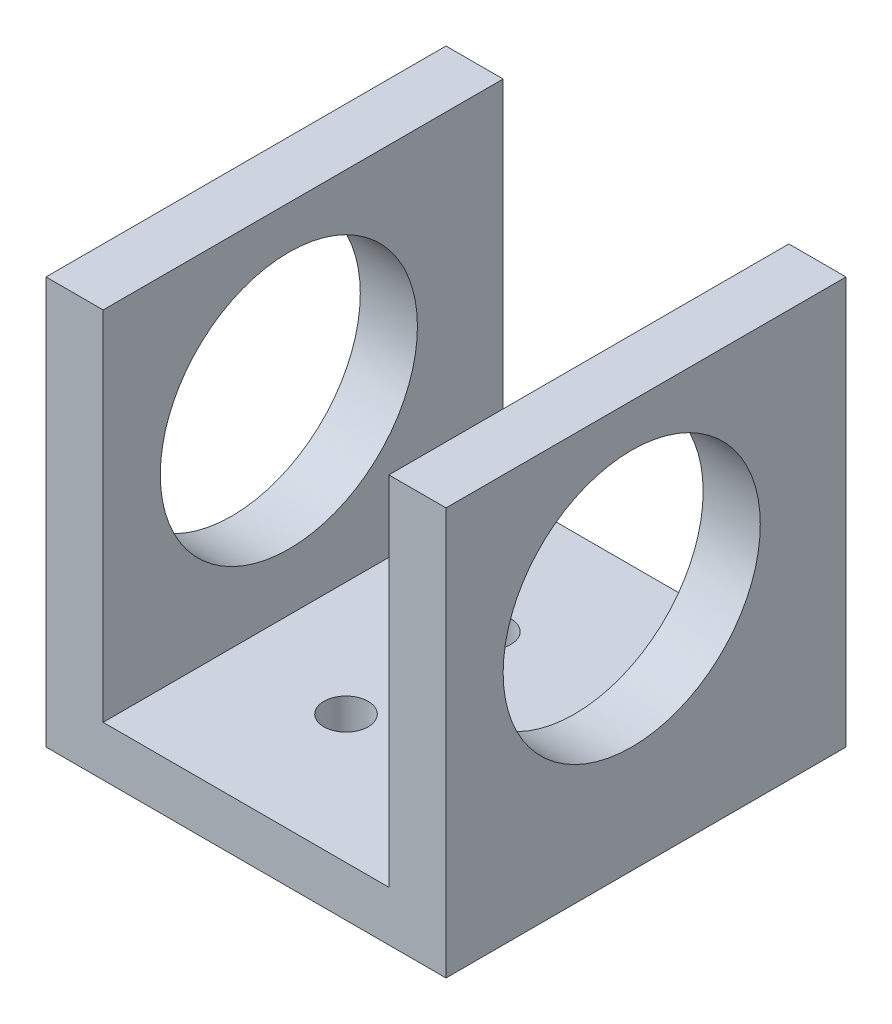
from build123d import *

# Parameters (mm, degrees)
SKETCH_1_W          = 28
SKETCH_1_H          = 28
EXTRUDE_1_DEPTH     = 3.5
SKETCH_2_W          = 4
SKETCH_2_H          = 28
EXTRUDE_2_DEPTH     = 25
SKETCH_3_R          = 9
CUT_EXTRUDE_1_DEPTH = 50
SKETCH_4_R          = 1.55
CUT_EXTRUDE_2_DEPTH = 50


with BuildPart() as part:
    # 草图1 → 凸台-拉伸1 (new body)
    with BuildSketch(Plane(origin=(0, 0, 0), x_dir=(1, 0, 0), z_dir=(0, 1, 0))):
        with Locations((14, -14)):
            Rectangle(SKETCH_1_W, SKETCH_1_H)
    extrude(amount=EXTRUDE_1_DEPTH)

    # 草图2 → 凸台-拉伸2 (add)
    with BuildSketch(Plane(origin=(0, 3.5, 0), x_dir=(1, 0, 0), z_dir=(0, 1, 0))):
        with Locations((2, -14)):
            Rectangle(SKETCH_2_W, SKETCH_2_H)
        with Locations((26, -14)):
            Rectangle(SKETCH_2_W, SKETCH_2_H)
    extrude(amount=EXTRUDE_2_DEPTH)

    # 草图3 → 切除-拉伸1 (cut)
    with BuildSketch(Plane.ZY):
        with Locations((15, 16.5)):
            Circle(SKETCH_3_R)
    extrude(amount=-CUT_EXTRUDE_1_DEPTH, mode=Mode.SUBTRACT)

    # 草图4 → 切除-拉伸2 (cut)
    with BuildSketch(Plane(origin=(0, 3.5, 0), x_dir=(1, 0, 0), z_dir=(0, 1, 0))):
        with Locations(Location((12, -19, 0), (0, 0, 270))):
            Circle(SKETCH_4_R)
        with Locations(Location((12, -9, 0), (0, 0, 270))):
            Circle(SKETCH_4_R)
    extrude(amount=-CUT_EXTRUDE_2_DEPTH, mode=Mode.SUBTRACT)


solid = part.part
